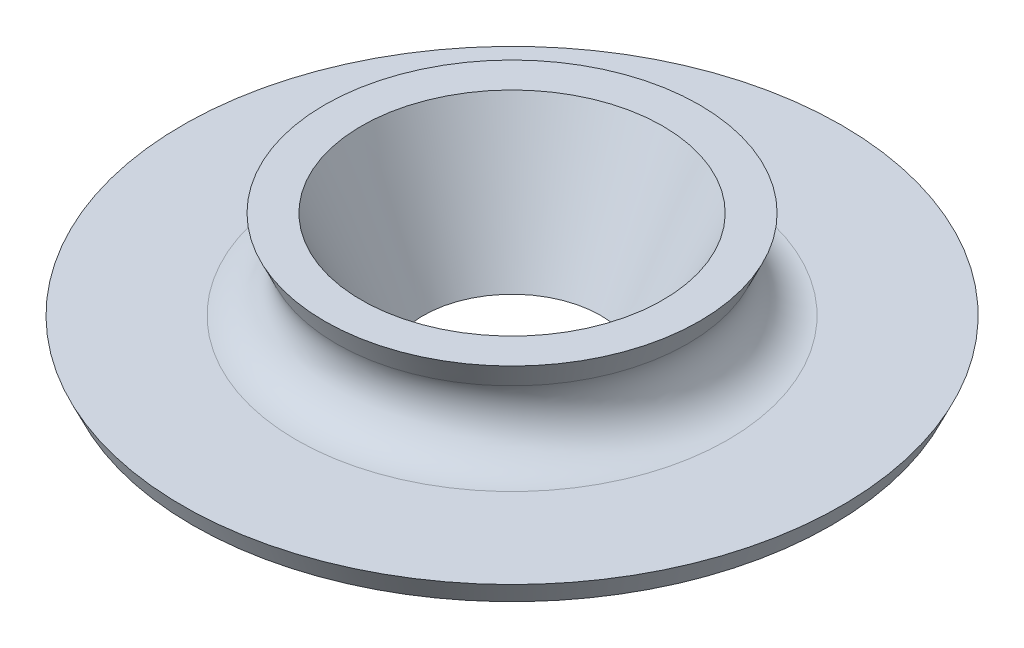
from build123d import *

# Parameters (mm, degrees)
FILLET1_R = 12.7


with BuildPart() as part:
    # Sketch1 → Revolve1 (revolve)
    with BuildSketch(Plane.XY, mode=Mode.PRIVATE) as revolve1_sk:
        Polygon((-25.4, 0.342101116), (-32.406449785, 0.342101116), (-35.367503415, 6.692101116), (-91.419101698, 6.692101116), (-94.380155327, 13.042101116), (-41.831781937, 13.042101116), (-53.675996454, 38.442101116), (-43.166321776, 38.442101116), align=None)
    revolve(revolve1_sk.sketch.rotate(Axis((0, 0, 0), (0, 1, 0)), 270), axis=Axis((0, 0, 0), (0, 1, 0)))

    # Fillet1
    fillet1_edges = [part.edges().sort_by_distance(p)[0] for p in [
        (0, 13.042101116, 41.831781937),
    ]]
    fillet(fillet1_edges, radius=FILLET1_R)


solid = part.part
